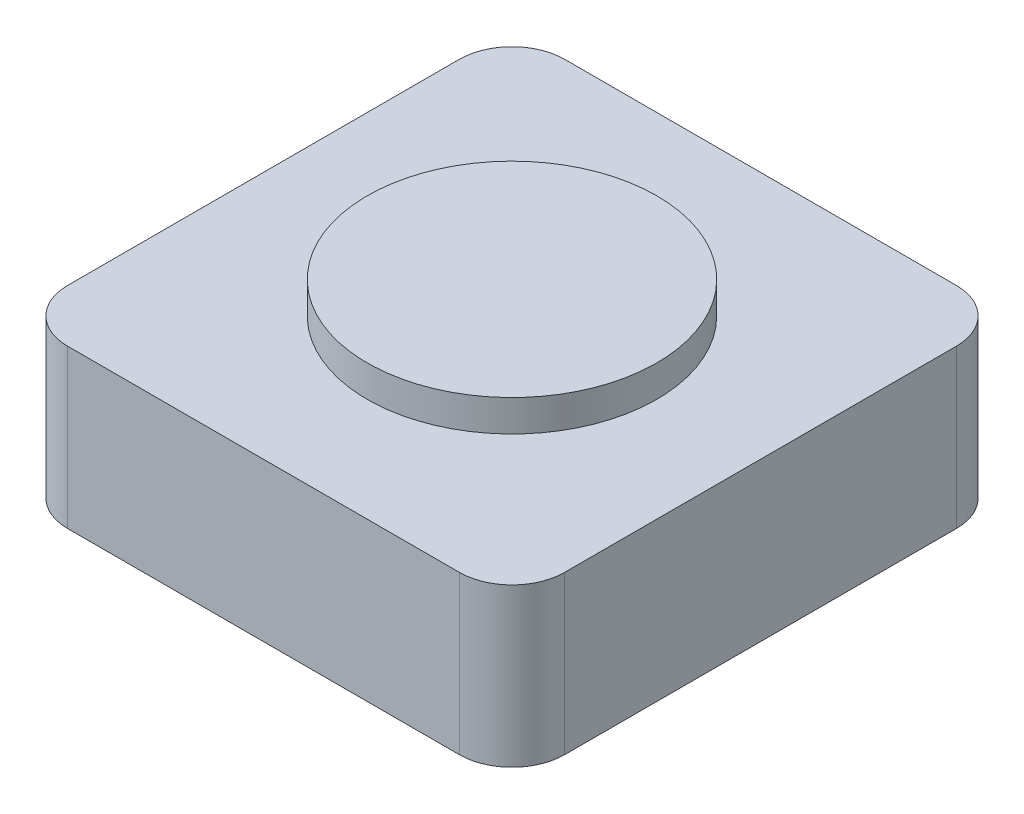
from build123d import *

# Parameters (mm, degrees)
SKETCH1_W           = 11.9888
SKETCH1_H           = 11.9888
BOSS_EXTRUDE1_DEPTH = 3.81
SKETCH2_R           = 3.4925
BOSS_EXTRUDE2_DEPTH = 0.762
FILLET3_R           = 1.27


with BuildPart() as part:
    # Sketch1 → Boss-Extrude1 (new body)
    with BuildSketch(Plane(origin=(0, 0, 0), x_dir=(1, 0, 0), z_dir=(0, 1, 0))):
        Rectangle(SKETCH1_W, SKETCH1_H)
    extrude(amount=BOSS_EXTRUDE1_DEPTH)

    # Sketch2 → Boss-Extrude2 (add)
    with BuildSketch(Plane(origin=(0, 3.81, 0), x_dir=(1, 0, 0), z_dir=(0, 1, 0))):
        with Locations(Location((0, 0, 0), (0, 0, 90))):
            Circle(SKETCH2_R)
    extrude(amount=BOSS_EXTRUDE2_DEPTH)

    # Fillet3
    fillet3_edges = [part.edges().sort_by_distance(p)[0] for p in [
        (5.9944, 1.905, 5.9944),
        (-5.9944, 1.905, 5.9944),
        (-5.9944, 1.905, -5.9944),
        (5.9944, 1.905, -5.9944),
    ]]
    fillet(fillet3_edges, radius=FILLET3_R)


solid = part.part
